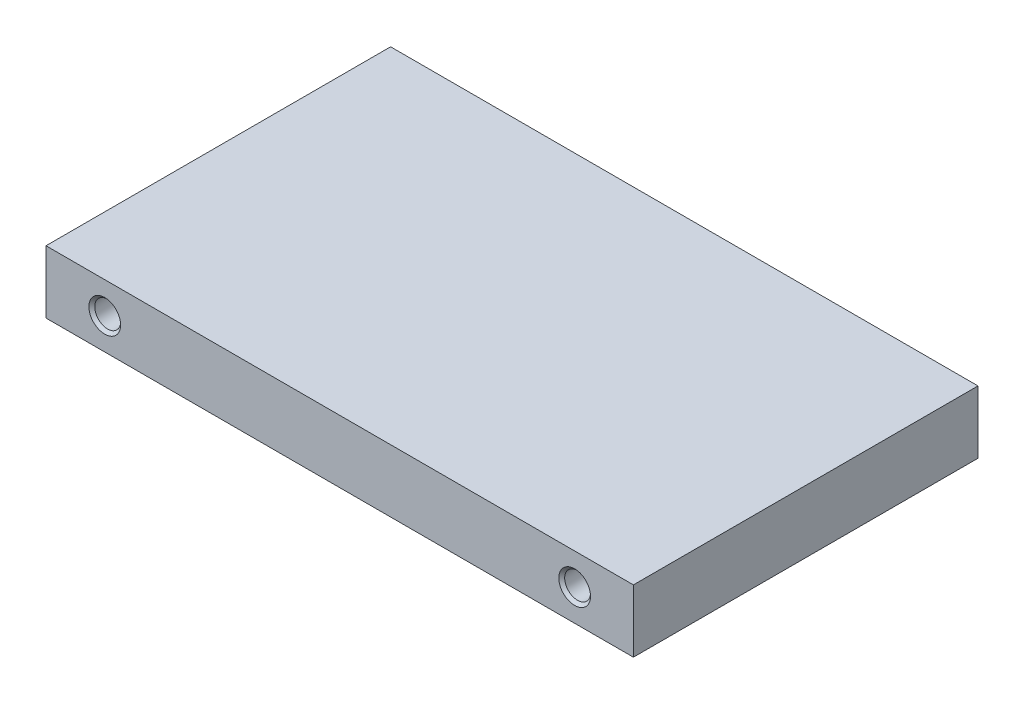
from build123d import *

# Parameters (mm, degrees)
SKETCH1_W                       = 75
SKETCH1_H                       = 44
BOSS_EXTRUDE2_DEPTH             = 8
M4X0_7_TAPPED_HOLE2_D           = 3.3
M4X0_7_TAPPED_HOLE2_CSINK_D     = 4.05
M4X0_7_TAPPED_HOLE2_CSINK_ANGLE = 90


with BuildPart() as part:
    # Sketch1 → Boss-Extrude2 (new body)
    with BuildSketch(Plane(origin=(0, 0, 0), x_dir=(1, 0, 0), z_dir=(0, 1, 0))):
        with Locations((-16, 0)):
            Rectangle(SKETCH1_W, SKETCH1_H)
    extrude(amount=BOSS_EXTRUDE2_DEPTH)

    # M4x0.7 Tapped Hole2 (through all)
    with Locations(Plane.XY.offset(22)):
        with Locations((-46, 4), (14, 4)):
            CounterSinkHole(M4X0_7_TAPPED_HOLE2_D / 2, M4X0_7_TAPPED_HOLE2_CSINK_D / 2, counter_sink_angle=M4X0_7_TAPPED_HOLE2_CSINK_ANGLE)


solid = part.part
